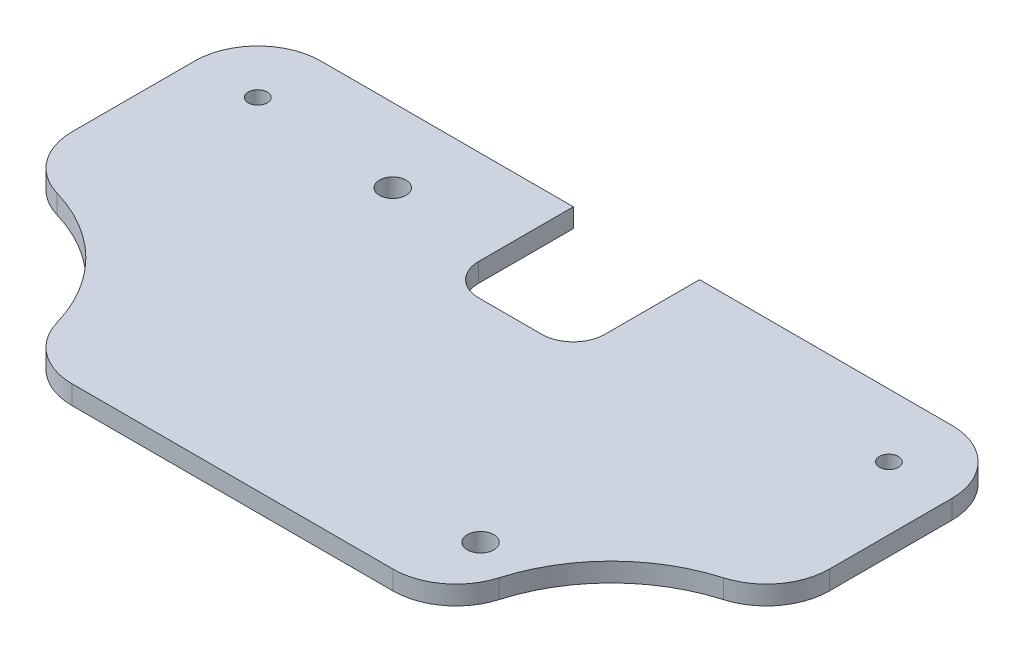
from build123d import *

# Parameters (mm, degrees)
SKETCH_1_W          = 120
SKETCH_1_H          = 64
EXTRUDE_1_DEPTH     = 3
SKETCH_2_R          = 1.5
CUT_EXTRUDE_1_DEPTH = 3
FILLET_1_R          = 10
SKETCH_3_W          = 20
SKETCH_3_H          = 20
CUT_EXTRUDE_2_DEPTH = 3
SKETCH_4_R          = 26
CUT_EXTRUDE_3_DEPTH = 3
FILLET_2_R          = 5
FILLET_3_R          = 10
FILLET_4_R          = 10
SKETCH_6_R          = 2.1
CUT_EXTRUDE_5_DEPTH = 6


with BuildPart() as part:
    # 草图1 → 凸台-拉伸1 (new body)
    with BuildSketch(Plane(origin=(0, 0, 0), x_dir=(1, 0, 0), z_dir=(0, 1, 0))):
        Rectangle(SKETCH_1_W, SKETCH_1_H)
    extrude(amount=EXTRUDE_1_DEPTH)

    # 草图2 → 切除-拉伸1 (cut)
    with BuildSketch(Plane(origin=(0, 3, 0), x_dir=(1, 0, 0), z_dir=(0, 1, 0))):
        with Locations(Location((-50, 22, 0), (0, 0, 270))):
            Circle(SKETCH_2_R)
        with Locations(Location((50, 22, 0), (0, 0, 90))):
            Circle(SKETCH_2_R)
    extrude(amount=-CUT_EXTRUDE_1_DEPTH, mode=Mode.SUBTRACT)

    # 圆角1
    fillet_1_edges = [part.edges().sort_by_distance(p)[0] for p in [
        (-60, 1.5, -32),
        (60, 1.5, -32),
    ]]
    fillet(fillet_1_edges, radius=FILLET_1_R)

    # 草图3 → 切除-拉伸2 (cut)
    with BuildSketch(Plane.XZ):
        with Locations((0, -22)):
            Rectangle(SKETCH_3_W, SKETCH_3_H)
    extrude(amount=-CUT_EXTRUDE_2_DEPTH, mode=Mode.SUBTRACT)

    # 草图4 → 切除-拉伸3 (cut)
    with BuildSketch(Plane.XZ):
        with Locations((-60, 32)):
            Circle(SKETCH_4_R)
        with Locations((60, 32)):
            Circle(SKETCH_4_R)
    extrude(amount=-CUT_EXTRUDE_3_DEPTH, mode=Mode.SUBTRACT)

    # 圆角2
    fillet_2_edges = [part.edges().sort_by_distance(p)[0] for p in [
        (-10, 1.5, -12),
        (10, 1.5, -12),
    ]]
    fillet(fillet_2_edges, radius=FILLET_2_R)

    # 圆角3
    fillet_3_edges = [part.edges().sort_by_distance(p)[0] for p in [
        (-60, 1.5, 6),
        (60, 1.5, 6),
    ]]
    fillet(fillet_3_edges, radius=FILLET_3_R)

    # 圆角4
    fillet_4_edges = [part.edges().sort_by_distance(p)[0] for p in [
        (-34, 1.5, 32),
        (34, 1.5, 32),
    ]]
    fillet(fillet_4_edges, radius=FILLET_4_R)

    # 草图6 → 切除-拉伸5 (cut)
    with BuildSketch(Plane(origin=(0, 3, 189.146349293), x_dir=(0, 0, 1), z_dir=(0, 1, 0))):
        with Locations((-209.45594255, -26.921391455)):
            Circle(SKETCH_6_R)
        with Locations((-167.762204108, 28.683304163)):
            Circle(SKETCH_6_R)
    extrude(amount=-CUT_EXTRUDE_5_DEPTH, mode=Mode.SUBTRACT)


solid = part.part
